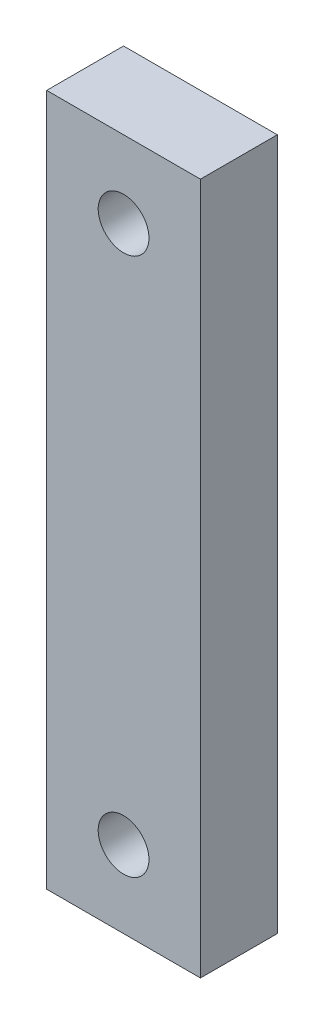
from build123d import *

# Parameters (mm, degrees)
SKETCH_1_W      = 10
SKETCH_1_H      = 45
SKETCH_1_R      = 1.65
EXTRUDE_1_DEPTH = 5


with BuildPart() as part:
    # 草图1 → 凸台-拉伸1 (new body)
    with BuildSketch(Plane.XY):
        Rectangle(SKETCH_1_W, SKETCH_1_H)
        with Locations((0, 17.5)):
            Circle(SKETCH_1_R, mode=Mode.SUBTRACT)
        with Locations((0, -17.5)):
            Circle(SKETCH_1_R, mode=Mode.SUBTRACT)
    extrude(amount=EXTRUDE_1_DEPTH)


solid = part.part
